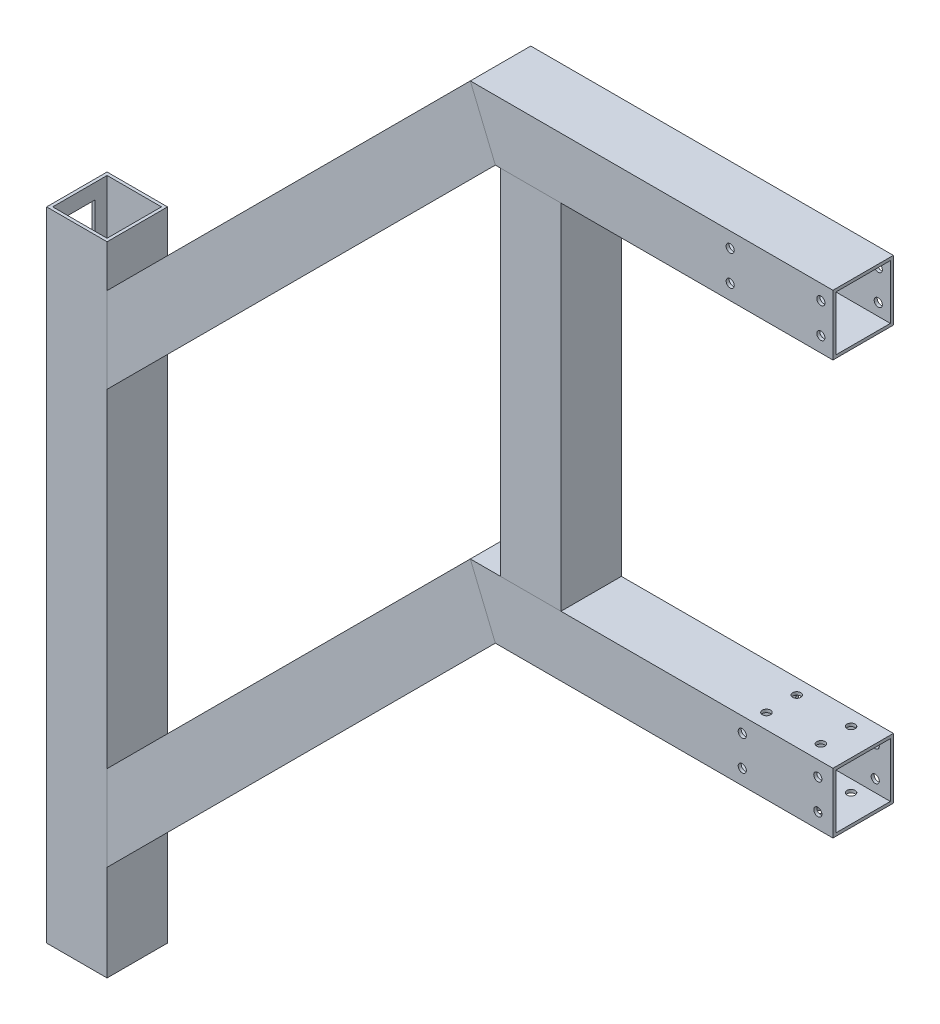
from build123d import *

# Parameters (mm, degrees)
SKETCH1_W                = 20
SKETCH1_H                = 20
SKETCH1_W_2              = 18
SKETCH1_H_2              = 18
F_20_X_20_X_2_1_DEPTH    = 130.262096827
SKETCH1_ON_SEGMENT_2_W   = 20
SKETCH1_ON_SEGMENT_2_H   = 20
SKETCH1_ON_SEGMENT_2_W_2 = 18
SKETCH1_ON_SEGMENT_2_H_2 = 18
F_20_X_20_X_2_1_2_DEPTH  = 231.902776602
SKETCH1_ON_SEGMENT_3_W   = 20
SKETCH1_ON_SEGMENT_3_H   = 20
SKETCH1_ON_SEGMENT_3_W_2 = 18
SKETCH1_ON_SEGMENT_3_H_2 = 18
F_20_X_20_X_2_1_3_DEPTH  = 130.262096827
SKETCH1_ON_SEGMENT_4_W   = 20
SKETCH1_ON_SEGMENT_4_H   = 20
SKETCH1_ON_SEGMENT_4_W_2 = 18
SKETCH1_ON_SEGMENT_4_H_2 = 18
F_20_X_20_X_2_1_4_DEPTH  = 231.902776602
SKETCH1_ON_SEGMENT_5_W   = 20
SKETCH1_ON_SEGMENT_5_H   = 20
SKETCH1_ON_SEGMENT_5_W_2 = 18
SKETCH1_ON_SEGMENT_5_H_2 = 18
F_20_X_20_X_2_1_5_DEPTH  = 139
SKETCH1_ON_SEGMENT_6_W   = 20
SKETCH1_ON_SEGMENT_6_H   = 20
SKETCH1_ON_SEGMENT_6_W_2 = 18
SKETCH1_ON_SEGMENT_6_H_2 = 18
F_20_X_20_X_2_1_6_DEPTH  = 211
SKETCH_3_R               = 1.35
CUT_EXTRUDE_1_DEPTH      = 381.722203901
CUT_EXTRUDE_2_REACH      = 307.733
SKETCH_4_R               = 1.35
SKETCH_5_W               = 10
SKETCH_5_H               = 20
CUT_EXTRUDE_3_DEPTH      = 1


with BuildPart() as part:
    # Sketch1 → 方形管 20 X 20 X 2(1) (new body)
    with BuildSketch(Plane(origin=(260.205132574, 277.205132574, 0), x_dir=(0, -1, 0), z_dir=(-1, 0, 0))):
        with Locations((10, 0)):
            Rectangle(SKETCH1_W, SKETCH1_H)
        with Locations((10, 0)):
            Rectangle(SKETCH1_W_2, SKETCH1_H_2, mode=Mode.SUBTRACT)
    extrude(amount=F_20_X_20_X_2_1_DEPTH)

    # 方形管 20 X 20 X 2(1) mitre 1
    split(bisect_by=Plane(origin=(140.205132574, 277.205132574, 0), x_dir=(-0.382683432, 0.923879533, 0), z_dir=(0.923879533, 0.382683432, 0)), keep=Keep.TOP)


with BuildPart() as body_2:
    # Sketch1 on segment 2 (carried to segment 2) → 20 X 20 X 2_1 2 (new body)
    with BuildSketch(Plane(origin=(147.461530829, 284.461530829, 0), x_dir=(0.707106781, -0.707106781, 0), z_dir=(-0.707106781, -0.707106781, 0))):
        with Locations((10, 0)):
            Rectangle(SKETCH1_ON_SEGMENT_2_W, SKETCH1_ON_SEGMENT_2_H)
        with Locations((10, 0)):
            Rectangle(SKETCH1_ON_SEGMENT_2_W_2, SKETCH1_ON_SEGMENT_2_H_2, mode=Mode.SUBTRACT)
    extrude(amount=F_20_X_20_X_2_1_2_DEPTH)

    # 20 X 20 X 2_1 2 mitre 1
    split(bisect_by=Plane(origin=(140.205132574, 277.205132574, 0), x_dir=(0.382683432, -0.923879533, 0), z_dir=(-0.923879533, -0.382683432, 0)), keep=Keep.TOP)

    # 20 X 20 X 2_1 2 mitre 2
    split(bisect_by=Plane(origin=(20, 137, 0), x_dir=(0, 1, 0), z_dir=(1, 0, 0)), keep=Keep.TOP)


with BuildPart() as body_3:
    # Sketch1 on segment 3 (carried to segment 3) → 20 X 20 X 2_1 3 (new body)
    with BuildSketch(Plane(origin=(260.205132574, 140.205132574, 0), x_dir=(0, -1, 0), z_dir=(-1, 0, 0))):
        with Locations((10, 0)):
            Rectangle(SKETCH1_ON_SEGMENT_3_W, SKETCH1_ON_SEGMENT_3_H)
        with Locations((10, 0)):
            Rectangle(SKETCH1_ON_SEGMENT_3_W_2, SKETCH1_ON_SEGMENT_3_H_2, mode=Mode.SUBTRACT)
    extrude(amount=F_20_X_20_X_2_1_3_DEPTH)

    # 20 X 20 X 2_1 3 mitre 1
    split(bisect_by=Plane(origin=(140.205132574, 140.205132574, 0), x_dir=(-0.382683432, 0.923879533, 0), z_dir=(0.923879533, 0.382683432, 0)), keep=Keep.TOP)


with BuildPart() as body_4:
    # Sketch1 on segment 4 (carried to segment 4) → 20 X 20 X 2_1 4 (new body)
    with BuildSketch(Plane(origin=(147.461530829, 147.461530829, 0), x_dir=(0.707106781, -0.707106781, 0), z_dir=(-0.707106781, -0.707106781, 0))):
        with Locations((10, 0)):
            Rectangle(SKETCH1_ON_SEGMENT_4_W, SKETCH1_ON_SEGMENT_4_H)
        with Locations((10, 0)):
            Rectangle(SKETCH1_ON_SEGMENT_4_W_2, SKETCH1_ON_SEGMENT_4_H_2, mode=Mode.SUBTRACT)
    extrude(amount=F_20_X_20_X_2_1_4_DEPTH)

    # 20 X 20 X 2_1 4 mitre 1
    split(bisect_by=Plane(origin=(140.205132574, 140.205132574, 0), x_dir=(0.382683432, -0.923879533, 0), z_dir=(-0.923879533, -0.382683432, 0)), keep=Keep.TOP)

    # 20 X 20 X 2_1 4 mitre 2
    split(bisect_by=Plane.YZ.offset(20), keep=Keep.TOP)


with BuildPart() as body_5:
    # Sketch1 on segment 5 (carried to segment 5) → 20 X 20 X 2_1 5 (new body)
    with BuildSketch(Plane(origin=(150.205132574, 278.205132574, 0), x_dir=(1, 0, 0), z_dir=(0, -1, 0))):
        with Locations((10, 0)):
            Rectangle(SKETCH1_ON_SEGMENT_5_W, SKETCH1_ON_SEGMENT_5_H)
        with Locations((10, 0)):
            Rectangle(SKETCH1_ON_SEGMENT_5_W_2, SKETCH1_ON_SEGMENT_5_H_2, mode=Mode.SUBTRACT)
    extrude(amount=F_20_X_20_X_2_1_5_DEPTH)

    # 20 X 20 X 2_1 5 mitre 1
    split(bisect_by=Plane(origin=(150.205132574, 257.205132574, 0), x_dir=(1, 0, 0), z_dir=(0, -1, 0)), keep=Keep.TOP)

    # 20 X 20 X 2_1 5 mitre 2
    split(bisect_by=Plane(origin=(150.205132574, 140.205132574, 0), x_dir=(-1, 0, 0), z_dir=(0, 1, 0)), keep=Keep.TOP)


with BuildPart() as body_6:
    # Sketch1 on segment 6 (carried to segment 6) → 20 X 20 X 2_1 6 (new body)
    with BuildSketch(Plane.XZ.offset(-171)):
        with Locations((10, 0)):
            Rectangle(SKETCH1_ON_SEGMENT_6_W, SKETCH1_ON_SEGMENT_6_H)
        with Locations((10, 0)):
            Rectangle(SKETCH1_ON_SEGMENT_6_W_2, SKETCH1_ON_SEGMENT_6_H_2, mode=Mode.SUBTRACT)
    extrude(amount=F_20_X_20_X_2_1_6_DEPTH)

    # 草图5 → 切除-拉伸3 (cut)
    with BuildSketch(Plane.ZY):
        with Locations((0, -25)):
            Rectangle(SKETCH_5_W, SKETCH_5_H)
        with Locations((0, 156)):
            Rectangle(SKETCH_5_W, SKETCH_5_H)
    extrude(amount=-CUT_EXTRUDE_3_DEPTH, mode=Mode.SUBTRACT)


with BuildPart() as cut_extrude_1_tool:
    # 草图3 → 切除-拉伸1 (new, through all)
    with BuildSketch(Plane.XY.offset(10)):
        with Locations((256.205132574, 272.205132574)):
            Circle(SKETCH_3_R)
        with Locations(Location((226.205132574, 272.205132574, 0), (0, 0, 90))):
            Circle(SKETCH_3_R)
        with Locations((226.205132574, 262.205132574)):
            Circle(SKETCH_3_R)
        with Locations(Location((256.205132574, 262.205132574, 0), (0, 0, 90))):
            Circle(SKETCH_3_R)
        with Locations((255.205132574, 135.205132574)):
            Circle(SKETCH_3_R)
        with Locations(Location((255.205132574, 125.205132574, 0), (0, 0, 90))):
            Circle(SKETCH_3_R)
        with Locations((230.205132574, 125.205132574)):
            Circle(SKETCH_3_R)
        with Locations(Location((230.205132574, 135.205132574, 0), (0, 0, 90))):
            Circle(SKETCH_3_R)
    extrude(amount=-CUT_EXTRUDE_1_DEPTH)


with BuildPart() as part_1:
    add(part.part)

    # 切除-拉伸1: cut by cut_extrude_1_tool
    add(cut_extrude_1_tool.part, mode=Mode.SUBTRACT)


with BuildPart() as body_3_1:
    add(body_3.part)

    # 切除-拉伸1: cut by cut_extrude_1_tool
    add(cut_extrude_1_tool.part, mode=Mode.SUBTRACT)

    # 切除-拉伸2: up to this face of the body (flat: up to its plane)
    cut_extrude_2_end = Plane(body_3_1.part.faces().sort_by_distance((200.205132574, 140.205132574, 0))[0])
    # 草图4 → 切除-拉伸2 (cut, up to the picked face)
    with BuildSketch(Plane.XZ.offset(-120.205132574), mode=Mode.PRIVATE) as cut_extrude_2_sk1:
        with Locations(Location((251.205132574, 5, 0), (0, 0, 270))):
            Circle(SKETCH_4_R)
    cut_extrude_2_tool1 = split(extrude(cut_extrude_2_sk1.sketch, amount=-CUT_EXTRUDE_2_REACH, mode=Mode.PRIVATE), bisect_by=cut_extrude_2_end, keep=Keep.BOTH, mode=Mode.PRIVATE)
    # 草图4 → 切除-拉伸2 (cut, up to the picked face)
    with BuildSketch(Plane.XZ.offset(-120.205132574), mode=Mode.PRIVATE) as cut_extrude_2_sk2:
        with Locations(Location((233.205132574, 5, 0), (0, 0, 270))):
            Circle(SKETCH_4_R)
    cut_extrude_2_tool2 = split(extrude(cut_extrude_2_sk2.sketch, amount=-CUT_EXTRUDE_2_REACH, mode=Mode.PRIVATE), bisect_by=cut_extrude_2_end, keep=Keep.BOTH, mode=Mode.PRIVATE)
    # 草图4 → 切除-拉伸2 (cut, up to the picked face)
    with BuildSketch(Plane.XZ.offset(-120.205132574), mode=Mode.PRIVATE) as cut_extrude_2_sk3:
        with Locations(Location((233.205132574, -5, 0), (0, 0, 270))):
            Circle(SKETCH_4_R)
    cut_extrude_2_tool3 = split(extrude(cut_extrude_2_sk3.sketch, amount=-CUT_EXTRUDE_2_REACH, mode=Mode.PRIVATE), bisect_by=cut_extrude_2_end, keep=Keep.BOTH, mode=Mode.PRIVATE)
    # 草图4 → 切除-拉伸2 (cut, up to the picked face)
    with BuildSketch(Plane.XZ.offset(-120.205132574), mode=Mode.PRIVATE) as cut_extrude_2_sk4:
        with Locations(Location((251.205132574, -5, 0), (0, 0, 270))):
            Circle(SKETCH_4_R)
    cut_extrude_2_tool4 = split(extrude(cut_extrude_2_sk4.sketch, amount=-CUT_EXTRUDE_2_REACH, mode=Mode.PRIVATE), bisect_by=cut_extrude_2_end, keep=Keep.BOTH, mode=Mode.PRIVATE)
    add(cut_extrude_2_tool1.solids().sort_by(Axis((251.205133, 120.205133, 5), (0, 1, 0)))[0], mode=Mode.SUBTRACT)
    add(cut_extrude_2_tool2.solids().sort_by(Axis((233.205133, 120.205133, 5), (0, 1, 0)))[0], mode=Mode.SUBTRACT)
    add(cut_extrude_2_tool3.solids().sort_by(Axis((233.205133, 120.205133, -5), (0, 1, 0)))[0], mode=Mode.SUBTRACT)
    add(cut_extrude_2_tool4.solids().sort_by(Axis((251.205133, 120.205133, -5), (0, 1, 0)))[0], mode=Mode.SUBTRACT)


solid = Compound([body_2.part, body_4.part, body_5.part, body_6.part, part_1.part, body_3_1.part])
